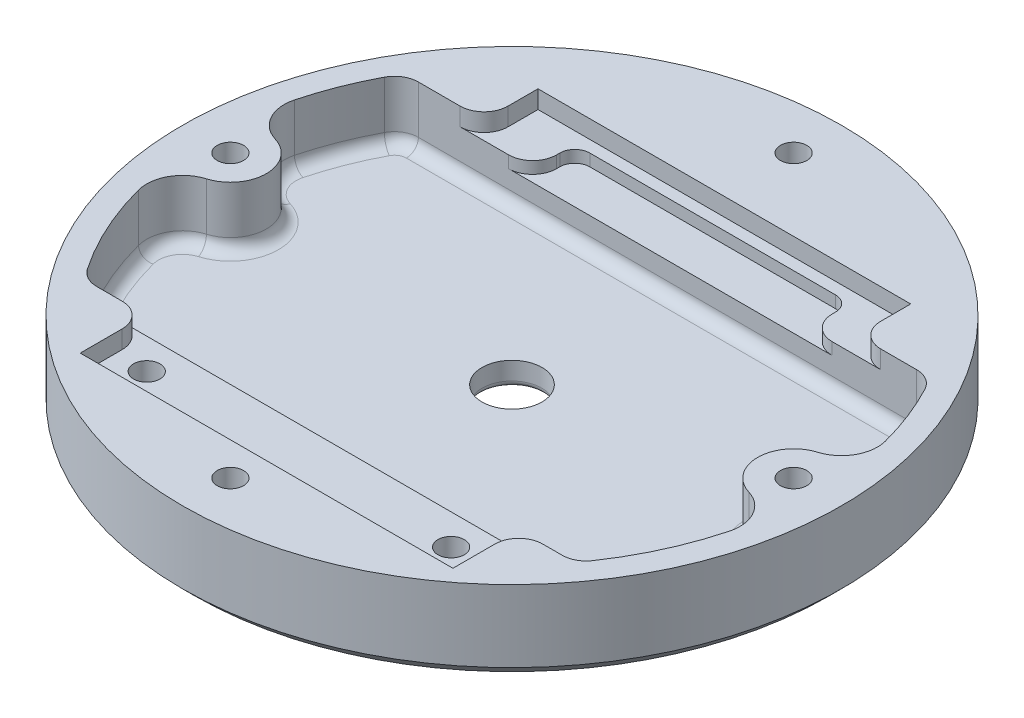
from build123d import *

# Parameters (mm, degrees)
SKETCH_1_R          = 27.5
EXTRUDE_1_DEPTH     = 2
EXTRUDE_START       = 5
SKETCH_2_R          = 27.5
SKETCH_2_R_2        = 25.5
EXTRUDE_2_DEPTH     = 5
EXTRUDE_3_DEPTH     = 5
SKETCH_6_W          = 31.1
SKETCH_6_H          = 38.2
CUT_EXTRUDE_1_DEPTH = 1.5
CUT_EXTRUDE_2_DEPTH = 1
SKETCH_8_R          = 1.1
CUT_EXTRUDE_3_DEPTH = 40.277856357
EXTRUDE_4_REACH     = 41.516
SKETCH_10_R         = 1.1
CUT_EXTRUDE_4_DEPTH = 40.515819617
CUT_EXTRUDE_5_DEPTH = 2.2
FILLET_1_R          = 2
FILLET_2_R          = 3
CHAMFER_1_SIZE      = 1
SKETCH_13_R         = 2.5
CUT_EXTRUDE_6_DEPTH = 40.210968006
FILLET_3_R          = 0.5
FILLET_4_R          = 1


with BuildPart() as part:
    # Эскиз1 → Бобышка-Вытянуть1 (new body)
    with BuildSketch(Plane(origin=(0, 0, 0), x_dir=(1, 0, 0), z_dir=(0, 1, 0))):
        with Locations(Location((0, 0, 0), (0, 0, 270))):
            Circle(SKETCH_1_R)
    extrude(amount=-EXTRUDE_1_DEPTH)

    # Эскиз2 → Бобышка-Вытянуть2 (add)
    with BuildSketch(Plane(origin=(0, 0, 0), x_dir=(1, 0, 0), z_dir=(0, 1, 0)).offset(EXTRUDE_START)):
        with Locations(Location((0, 0, 0), (0, 0, 270))):
            Circle(SKETCH_2_R)
        with Locations(Location((0, 0, 0), (0, 0, 270))):
            Circle(SKETCH_2_R_2, mode=Mode.SUBTRACT)
    extrude(amount=-EXTRUDE_2_DEPTH)

    # Эскиз3 → Бобышка-Вытянуть3 (add)
    with BuildSketch(Plane(origin=(0, 0, 0), x_dir=(1, 0, 0), z_dir=(0, 1, 0)).offset(EXTRUDE_START)):
        with BuildLine():
            ThreePointArc((21.955161124, 12.97), (0, 25.5), (-21.955161124, 12.97))
            Line((-21.955161124, 12.97), (21.955161124, 12.97))
        make_face()
        with BuildLine():
            Line((20.452312828, -15.23), (-20.452312828, -15.23))
            ThreePointArc((-20.452312828, -15.23), (0, -25.5), (20.452312828, -15.23))
        make_face()
    extrude(amount=-EXTRUDE_3_DEPTH)

    # Эскиз6 → Вырез-Вытянуть1 (cut)
    with BuildSketch(Plane(origin=(0, 5, 0), x_dir=(1, 0, 0), z_dir=(0, 1, 0))):
        with Locations((0.25, -1.63)):
            Rectangle(SKETCH_6_W, SKETCH_6_H)
    extrude(amount=-CUT_EXTRUDE_1_DEPTH, mode=Mode.SUBTRACT)

    # Эскиз7 → Вырез-Вытянуть2 (cut)
    with BuildSketch(Plane(origin=(0, 3.5, 0), x_dir=(1, 0, 0), z_dir=(0, 1, 0))):
        with BuildLine():
            Line((-10, 13.99), (10.5, 13.99))
            ThreePointArc((10.5, 13.99), (11.75, 15.24), (10.5, 16.49))
            Line((10.5, 16.49), (-10, 16.49))
            ThreePointArc((-10, 16.49), (-11.25, 15.24), (-10, 13.99))
        make_face()
        with BuildLine():
            ThreePointArc((-10, 13.99), (-10.883883476, 14.356116524), (-11.25, 15.24))
            Line((-11.25, 15.24), (-11.25, 12.97))
            Line((-11.25, 12.97), (11.75, 12.97))
            Line((11.75, 12.97), (11.75, 15.24))
            ThreePointArc((11.75, 15.24), (11.383883476, 14.356116524), (10.5, 13.99))
            Line((10.5, 13.99), (-10, 13.99))
        make_face()
    extrude(amount=-CUT_EXTRUDE_2_DEPTH, mode=Mode.SUBTRACT)

    # Эскиз8 → Вырез-Вытянуть3 (cut, through all)
    with BuildSketch(Plane(origin=(0, 3.5, 0), x_dir=(1, 0, 0), z_dir=(0, 1, 0))):
        with Locations(Location((-12.7, -17.78, 0), (0, 0, 270))):
            Circle(SKETCH_8_R)
        with Locations(Location((12.7, -17.78, 0), (0, 0, 90))):
            Circle(SKETCH_8_R)
    extrude(amount=-CUT_EXTRUDE_3_DEPTH, mode=Mode.SUBTRACT)

    # Эскиз9 → Бобышка-Вытянуть4 (add, up to next)
    with BuildSketch(Plane(origin=(0, 5, 0), x_dir=(1, 0, 0), z_dir=(0, 1, 0)), mode=Mode.PRIVATE) as extrude_4_sk1:
        with BuildLine():
            Line((-23.5, 3), (-25.322914524, 3))
            ThreePointArc((-25.322914524, 3), (-25.5, 0), (-25.322914524, -3))
            Line((-25.322914524, -3), (-23.5, -3))
            ThreePointArc((-23.5, -3), (-20.5, 0), (-23.5, 3))
        make_face()
    extrude_4_tool1 = extrude(extrude_4_sk1.sketch, amount=-EXTRUDE_4_REACH, mode=Mode.PRIVATE) - part.part
    # Эскиз9 → Бобышка-Вытянуть4 (add, up to next)
    with BuildSketch(Plane(origin=(0, 5, 0), x_dir=(1, 0, 0), z_dir=(0, 1, 0)), mode=Mode.PRIVATE) as extrude_4_sk2:
        with BuildLine():
            Line((23.5, 3), (25.322914524, 3))
            ThreePointArc((25.322914524, 3), (25.5, 0), (25.322914524, -3))
            Line((25.322914524, -3), (23.5, -3))
            ThreePointArc((23.5, -3), (20.5, 0), (23.5, 3))
        make_face()
    extrude_4_tool2 = extrude(extrude_4_sk2.sketch, amount=-EXTRUDE_4_REACH, mode=Mode.PRIVATE) - part.part
    add(extrude_4_tool1.solids().sort_by_distance((-23.240587, 5, 0))[0])
    add(extrude_4_tool2.solids().sort_by_distance((23.240587, 5, 0))[0])

    # Эскиз10 → Вырез-Вытянуть4 (cut, through all)
    with BuildSketch(Plane(origin=(0, 5, 0), x_dir=(1, 0, 0), z_dir=(0, 1, 0))):
        with Locations(Location((0, 23.5, 0), (0, 0, 270))):
            Circle(SKETCH_10_R)
        with Locations(Location((23.5, 0, 0), (0, 0, 270))):
            Circle(SKETCH_10_R)
        with Locations(Location((0, -23.5, 0), (0, 0, 270))):
            Circle(SKETCH_10_R)
        with Locations(Location((-23.5, 0, 0), (0, 0, 270))):
            Circle(SKETCH_10_R)
    extrude(amount=-CUT_EXTRUDE_4_DEPTH, mode=Mode.SUBTRACT)

    # Эскиз11 → Вырез-Вытянуть5 (cut)
    with BuildSketch(Plane.XZ.offset(2)):
        Polygon((1.125833025, 21.55), (2.25166605, 23.5), (1.125833025, 25.45), (-1.125833025, 25.45), (-2.25166605, 23.5), (-1.125833025, 21.55), align=None)
        Polygon((13.825833025, 15.83), (14.95166605, 17.78), (13.825833025, 19.73), (11.574166975, 19.73), (10.44833395, 17.78), (11.574166975, 15.83), align=None)
        Polygon((-11.574166975, 15.83), (-13.825833025, 15.83), (-14.95166605, 17.78), (-13.825833025, 19.73), (-11.574166975, 19.73), (-10.44833395, 17.78), align=None)
        Polygon((21.55, -1.125833025), (23.5, -2.25166605), (25.45, -1.125833025), (25.45, 1.125833025), (23.5, 2.25166605), (21.55, 1.125833025), align=None)
        Polygon((-1.125833025, -21.55), (-2.25166605, -23.5), (-1.125833025, -25.45), (1.125833025, -25.45), (2.25166605, -23.5), (1.125833025, -21.55), align=None)
        Polygon((-21.55, 1.125833025), (-23.5, 2.25166605), (-25.45, 1.125833025), (-25.45, -1.125833025), (-23.5, -2.25166605), (-21.55, -1.125833025), align=None)
    extrude(amount=-CUT_EXTRUDE_5_DEPTH, mode=Mode.SUBTRACT)

    # Скругление1
    fillet_1_edges = [part.edges().sort_by_distance(p)[0] for p in [
        (21.955161124, 2.5, -12.97),
        (-21.955161124, 2.5, -12.97),
        (20.452312828, 2.5, 15.23),
        (-20.452312828, 2.5, 15.23),
        (-15.3, 4.25, 15.23),
        (15.8, 4.25, 15.23),
        (15.8, 4.25, -12.97),
        (-15.3, 4.25, -12.97),
        (11.75, 3, -12.97),
        (-11.25, 3, -12.97),
    ]]
    fillet(fillet_1_edges, radius=FILLET_1_R)

    # Скругление2
    fillet_2_edges = [part.edges().sort_by_distance(p)[0] for p in [
        (-25.322914524, 2.5, -3),
        (-25.322914524, 2.5, 3),
        (25.322914524, 2.5, 3),
        (25.322914524, 2.5, -3),
    ]]
    fillet(fillet_2_edges, radius=FILLET_2_R)

    # Фаска1
    chamfer_1_edges = [part.edges().sort_by_distance(p)[0] for p in [
        (0, -2, -27.5),
    ]]
    chamfer(chamfer_1_edges, length=CHAMFER_1_SIZE)

    # Эскиз13 → Вырез-Вытянуть6 (cut, through all)
    with BuildSketch(Plane(origin=(0, 0, 0), x_dir=(1, 0, 0), z_dir=(0, 1, 0))):
        with Locations(Location((0, 0, 0), (0, 0, 270))):
            Circle(SKETCH_13_R)
    extrude(amount=-CUT_EXTRUDE_6_DEPTH, mode=Mode.SUBTRACT)

    # Скругление3
    fillet_3_edges = [part.edges().sort_by_distance(p)[0] for p in [
        (0, -2, -2.5),
    ]]
    fillet(fillet_3_edges, radius=FILLET_3_R)

    # Скругление4
    fillet_4_edges = [part.edges().sort_by_distance(p)[0] for p in [
        (0, 0, 15.23),
        (23.75736274, 0, -9.264864578),
        (0, 0, -12.97),
        (-23.199935161, 0, 10.583619821),
        (21.815081072, 0, -12.682780494),
        (-21.815081072, 0, -12.682780494),
        (-20.356980074, 0, 14.998037739),
        (20.356980074, 0, 14.998037739),
        (-20.5, 0, 0),
        (-23.75736274, 0, -9.264864578),
        (23.199935161, 0, 10.583619821),
        (20.5, 0, 0),
        (24.375193048, 0, -4.279144112),
        (24.375193048, 0, 4.279144112),
        (-24.375193048, 0, 4.279144112),
        (-24.375193048, 0, -4.279144112),
    ]]
    fillet(fillet_4_edges, radius=FILLET_4_R)


solid = part.part
